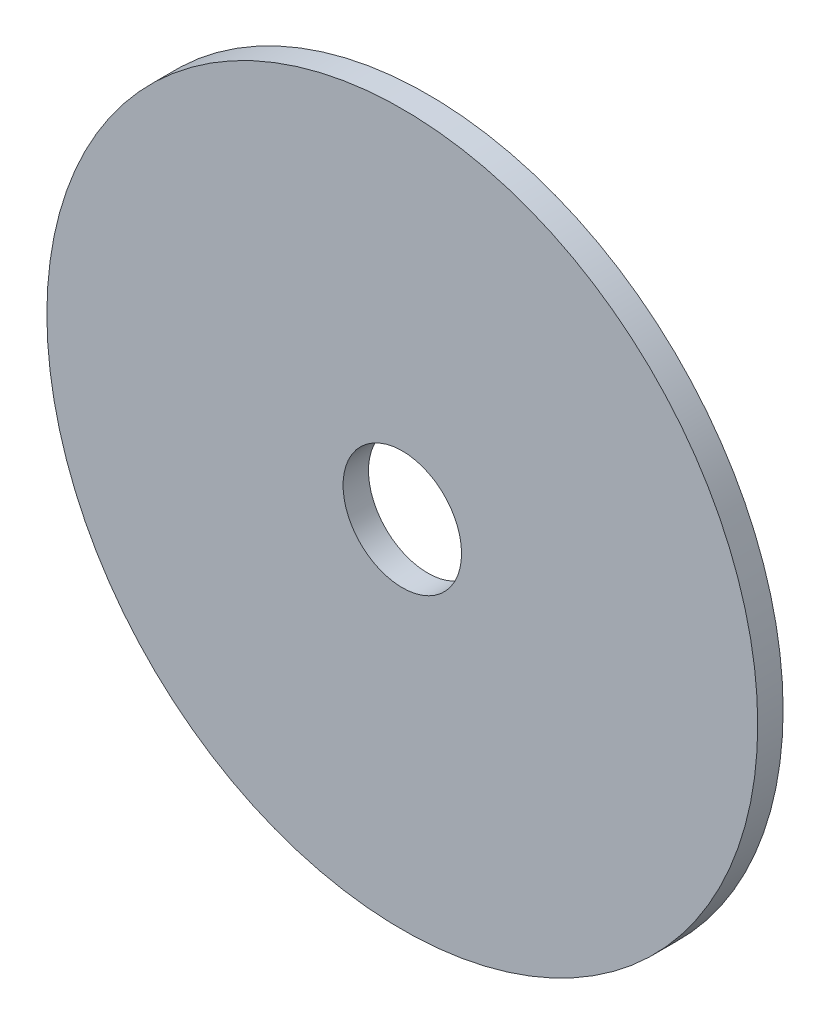
from build123d import *

# Parameters (mm, degrees)
CROQUIS1_W            = 1.5
CROQUIS1_H            = 21
CROQUIS2_R            = 3.5
CORTAR_EXTRUIR1_DEPTH = 30.736341402


with BuildPart() as part:
    # Croquis1 → Revolución1 (revolve)
    with BuildSketch(Plane(origin=(0, 0, 0), x_dir=(0, 0, -1), z_dir=(1, 0, 0)), mode=Mode.PRIVATE) as revoluci_n1_sk:
        with Locations((0.75, 10.5)):
            Rectangle(CROQUIS1_W, CROQUIS1_H)
    revolve(revoluci_n1_sk.sketch.rotate(Axis((0, 0, 0), (0, 0, -1)), 90), axis=Axis((0, 0, 0), (0, 0, -1)))

    # Croquis2 → Cortar-Extruir1 (cut, through all)
    with BuildSketch(Plane.XY):
        Circle(CROQUIS2_R)
    extrude(amount=-CORTAR_EXTRUIR1_DEPTH, mode=Mode.SUBTRACT)


solid = part.part
